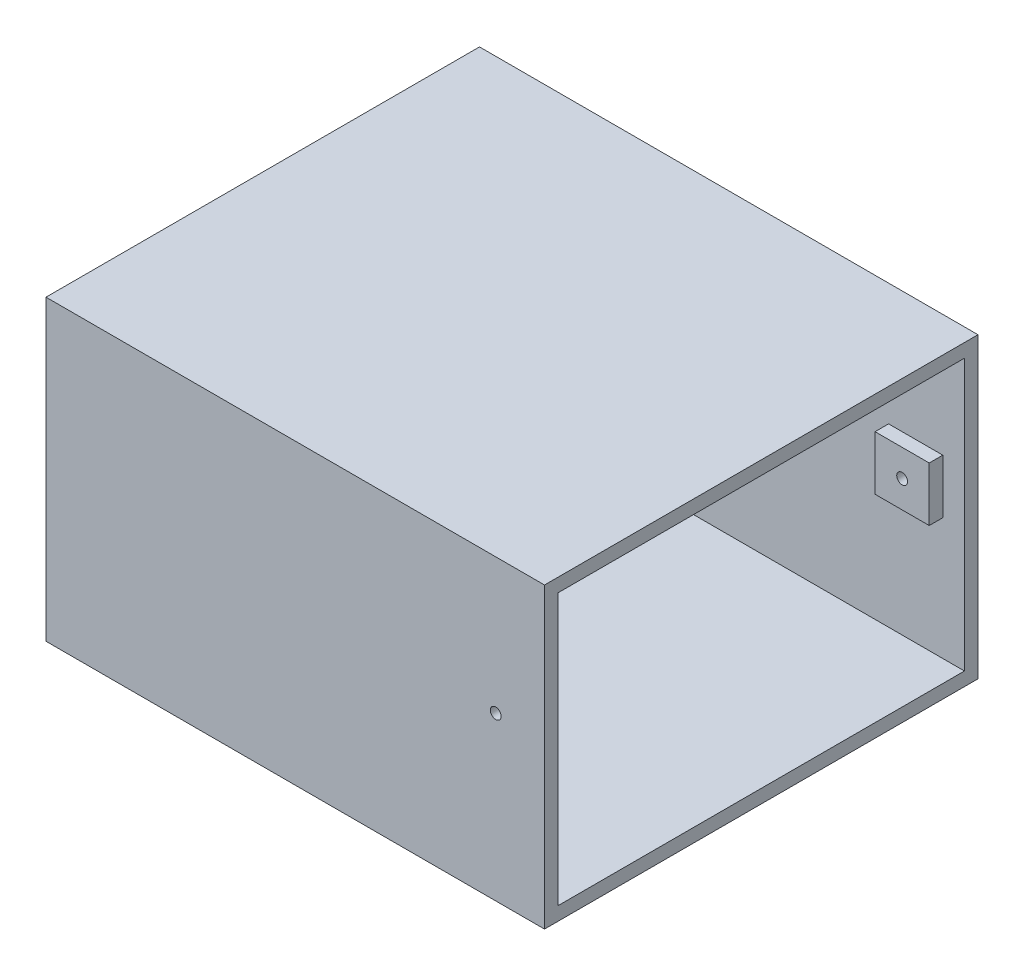
from build123d import *

# Parameters (mm, degrees)
ESBO_O2_W                = 80
ESBO_O2_H                = 55
RESSALTO_EXTRUS_O1_DEPTH = 92
ESBO_O3_W                = 75
ESBO_O3_H                = 50
CORTE_EXTRUS_O1_DEPTH    = 89.5
ESBO_O4_W                = 35
ESBO_O4_H                = 15
CORTE_EXTRUS_O2_DEPTH    = 2.5
ESBO_O5_R                = 1
CORTE_EXTRUS_O3_DEPTH    = 125.980998556
ESBO_O6_W                = 10
ESBO_O6_H                = 10
RESSALTO_EXTRUS_O2_DEPTH = 2.5
ESBO_O8_R                = 1
CORTE_EXTRUS_O4_DEPTH    = 122.841085025


with BuildPart() as part:
    # Esboço2 → Ressalto-extrusão1 (new body)
    with BuildSketch(Plane(origin=(0, 0, 0), x_dir=(0, 0, -1), z_dir=(1, 0, 0))):
        Rectangle(ESBO_O2_W, ESBO_O2_H)
    extrude(amount=-RESSALTO_EXTRUS_O1_DEPTH)

    # Esboço3 → Corte-extrusão1 (cut)
    with BuildSketch(Plane(origin=(0, 0, 0), x_dir=(0, 0, -1), z_dir=(1, 0, 0))):
        Rectangle(ESBO_O3_W, ESBO_O3_H)
    extrude(amount=-CORTE_EXTRUS_O1_DEPTH, mode=Mode.SUBTRACT)

    # Esboço4 → Corte-extrusão2 (cut)
    with BuildSketch(Plane.ZY.offset(92)):
        with Locations((-20, 9)):
            Rectangle(ESBO_O4_W, ESBO_O4_H)
    extrude(amount=-CORTE_EXTRUS_O2_DEPTH, mode=Mode.SUBTRACT)

    # Esboço5 → Corte-extrusão3 (cut, through all)
    with BuildSketch(Plane.XY.offset(40)):
        with Locations((-9, 2.5)):
            Circle(ESBO_O5_R)
    extrude(amount=-CORTE_EXTRUS_O3_DEPTH, mode=Mode.SUBTRACT)

    # Esboço6 → Ressalto-extrusão2 (add)
    with BuildSketch(Plane(origin=(0, 0, 37.5), x_dir=(-1, 0, 0), z_dir=(0, 0, -1))):
        with Locations((9, 2.5)):
            Rectangle(ESBO_O6_W, ESBO_O6_H)
    ressalto_extrus_o2 = extrude(amount=RESSALTO_EXTRUS_O2_DEPTH)

    # Esboço8 → Corte-extrusão4 (cut, through all)
    with BuildSketch(Plane(origin=(0, 0, 35), x_dir=(-1, 0, 0), z_dir=(0, 0, -1))):
        with Locations(Location((9, 2.5, 0), (0, 0, 180))):
            Circle(ESBO_O8_R)
    corte_extrus_o4 = extrude(amount=-CORTE_EXTRUS_O4_DEPTH, mode=Mode.SUBTRACT)

    # Espelhar3: Ressalto-extrusão2, Corte-extrusão4 across plane
    add(ressalto_extrus_o2.mirror(Plane.XY))
    add(corte_extrus_o4.mirror(Plane.XY), mode=Mode.SUBTRACT)


solid = part.part
